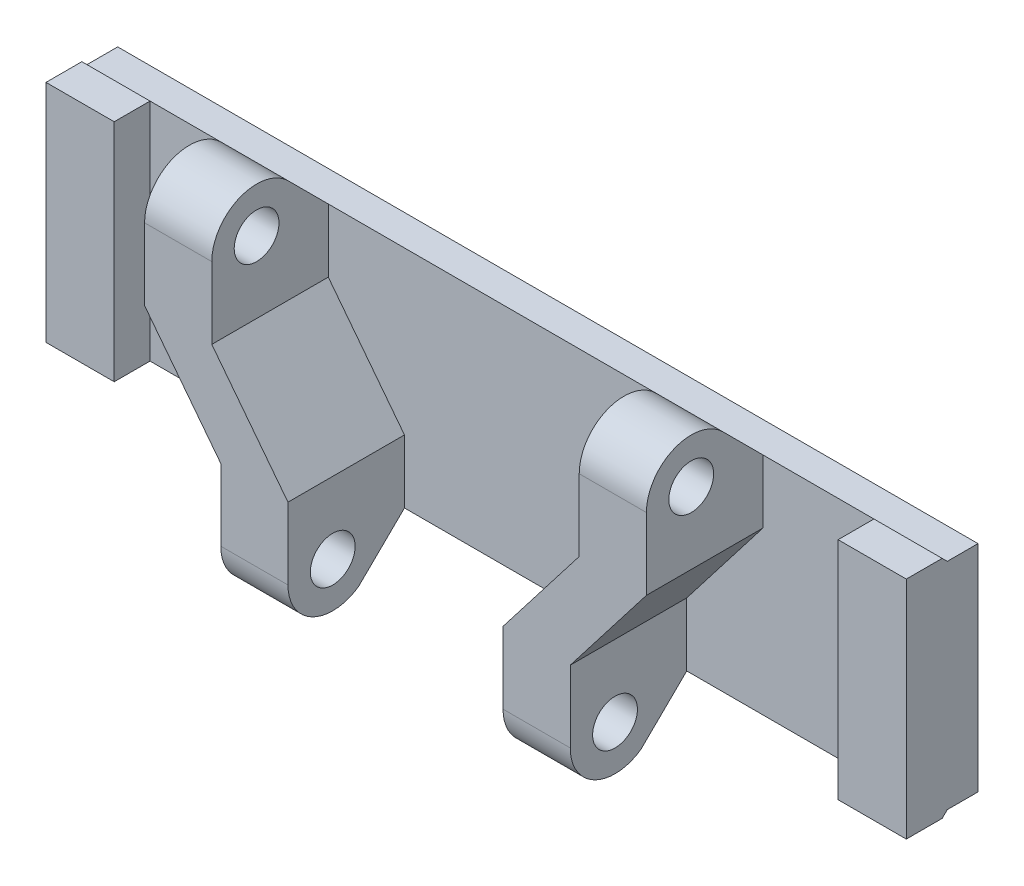
from build123d import *

# Parameters (mm, degrees)
ESBO_O9_R                         = 1.250000058
ESBO_O9_R_2                       = 1.250559391
RESSALTO_EXTRUS_O2_DEPTH          = 24
CORTE_EXTRUS_O5_DEPTH             = 28.088973642
CORTE_EXTRUS_O5_DEPTH_BACK        = 28.088973642
ESBO_O12_OUTSIDE_W                = 60.428
ESBO_O12_OUTSIDE_H                = 20.928
CORTE_EXTRUS_O6_REACH             = 29.089
ESBO_O13_W                        = 3.805227374
ESBO_O13_H                        = 1.999999904
ESBO_O13_W_2                      = 36.154186404
ESBO_O13_H_2                      = 31.243547385
ESBO_O13_H_3                      = 1.961388226
CORTE_EXTRUS_O6_DIRECTION_2_DEPTH = 5000


with BuildPart() as part:
    # Esboço9 → Ressalto-extrusão2 (new, symmetric)
    with BuildSketch(Plane(origin=(0, 0, 0), x_dir=(0, 0, -1), z_dir=(1, 0, 0))):
        with BuildLine():
            Line((0, -5.999999999), (0, 5.999999999))
            Line((0, 5.999999999), (-1.714464294, 6.00000012))
            Line((-1.714464294, 6.00000012), (-4.232231545, 8.517767251))
            ThreePointArc((-4.232231545, 8.517767251), (-6.956707169, 9.059699215), (-8.499999099, 6.7500006))
            Line((-8.499999099, 6.7500006), (-8.499999099, -6.749999877))
            ThreePointArc((-8.499999099, -6.749999877), (-7.153358538, -8.968070124), (-4.564293582, -8.794809974))
            Line((-4.564293582, -8.794809974), (-1.714465141, -5.999999999))
            Line((-1.714465141, -5.999999999), (0, -5.999999999))
        make_face()
        with Locations((-5.999998683, 6.749999894)):
            Circle(ESBO_O9_R, mode=Mode.SUBTRACT)
        with Locations((-6.001403792, -6.750869293)):
            Circle(ESBO_O9_R_2, mode=Mode.SUBTRACT)
    extrude(amount=RESSALTO_EXTRUS_O2_DEPTH, both=True)

    # Esboço12 outside → Corte-extrusão5 (cut, two sides: drawn at the far end of the back side and taken through both)
    with BuildSketch(Plane(origin=(0, 0, 0), x_dir=(1, 0, 0), z_dir=(0, 1, 0)).offset(-CORTE_EXTRUS_O5_DEPTH_BACK)):
        with Locations((0, -4.25)):
            Rectangle(ESBO_O12_OUTSIDE_W, ESBO_O12_OUTSIDE_H)
        Polygon((-24, -4), (-24, 0), (24, 0), (24, -4), (20.194772626, -4), (20.194772626, -2), (14, -2), (14, -9.171977472), (6, -9.171977472), (6, -2), (-6, -2), (-6, -9.171977472), (-14, -9.171977472), (-14, -2), (-20.194772626, -2), (-20.194772626, -4), align=None, mode=Mode.SUBTRACT)
    extrude(amount=CORTE_EXTRUS_O5_DEPTH + CORTE_EXTRUS_O5_DEPTH_BACK, mode=Mode.SUBTRACT)

    # Corte-extrusão6: up to this face of the body (flat: up to its plane)
    corte_extrus_o6_end = Plane(part.part.faces().sort_by_distance((-17.097386313, 0.002756729, 2))[0])
    # Esboço13 → Corte-extrusão6 (cut, up to the picked face)
    with BuildSketch(Plane.XY.offset(8.499999099), mode=Mode.PRIVATE) as corte_extrus_o6_sk1:
        with Locations((-22.097386313, 7.285535765)):
            Rectangle(ESBO_O13_W, ESBO_O13_H)
    corte_extrus_o6_tool1 = split(extrude(corte_extrus_o6_sk1.sketch, amount=-CORTE_EXTRUS_O6_REACH, mode=Mode.PRIVATE), bisect_by=corte_extrus_o6_end, keep=Keep.BOTH, mode=Mode.PRIVATE)
    # Esboço13 → Corte-extrusão6 (cut, up to the picked face)
    with BuildSketch(Plane.XY.offset(8.499999099), mode=Mode.PRIVATE) as corte_extrus_o6_sk2:
        with Locations((-0.25062362, -2.463016757)):
            Rectangle(ESBO_O13_W_2, ESBO_O13_H_2)
        Polygon((-14, 9.25000031), (-14, 2.75000031), (-9.75, -2.749464751), (-9.75, -9.249464751), (-6, -9.249464751), (-6, -2.749464751), (-10.25, 2.75000031), (-10.25, 9.25000031), align=None, mode=Mode.SUBTRACT)
        Polygon((6, -2.749464751), (6, -9.249464751), (9.75, -9.249464751), (9.75, -2.749464751), (14, 2.75000031), (14, 9.25000031), (10.25, 9.25000031), (10.25, 2.75000031), align=None, mode=Mode.SUBTRACT)
    corte_extrus_o6_tool2 = split(extrude(corte_extrus_o6_sk2.sketch, amount=-CORTE_EXTRUS_O6_REACH, mode=Mode.PRIVATE), bisect_by=corte_extrus_o6_end, keep=Keep.BOTH, mode=Mode.PRIVATE)
    # Esboço13 → Corte-extrusão6 (cut, up to the picked face)
    with BuildSketch(Plane.XY.offset(8.499999099), mode=Mode.PRIVATE) as corte_extrus_o6_sk3:
        with Locations((-22.097386313, -7.260716467)):
            Rectangle(ESBO_O13_W, ESBO_O13_H_3)
    corte_extrus_o6_tool3 = split(extrude(corte_extrus_o6_sk3.sketch, amount=-CORTE_EXTRUS_O6_REACH, mode=Mode.PRIVATE), bisect_by=corte_extrus_o6_end, keep=Keep.BOTH, mode=Mode.PRIVATE)
    # Esboço13 → Corte-extrusão6 (cut, up to the picked face)
    with BuildSketch(Plane.XY.offset(8.499999099), mode=Mode.PRIVATE) as corte_extrus_o6_sk4:
        with Locations((22.097386313, 7.285535765)):
            Rectangle(ESBO_O13_W, ESBO_O13_H)
    corte_extrus_o6_tool4 = split(extrude(corte_extrus_o6_sk4.sketch, amount=-CORTE_EXTRUS_O6_REACH, mode=Mode.PRIVATE), bisect_by=corte_extrus_o6_end, keep=Keep.BOTH, mode=Mode.PRIVATE)
    # Esboço13 → Corte-extrusão6 (cut, up to the picked face)
    with BuildSketch(Plane.XY.offset(8.499999099), mode=Mode.PRIVATE) as corte_extrus_o6_sk5:
        with Locations((22.097386313, -7.260716467)):
            Rectangle(ESBO_O13_W, ESBO_O13_H_3)
    corte_extrus_o6_tool5 = split(extrude(corte_extrus_o6_sk5.sketch, amount=-CORTE_EXTRUS_O6_REACH, mode=Mode.PRIVATE), bisect_by=corte_extrus_o6_end, keep=Keep.BOTH, mode=Mode.PRIVATE)
    add(corte_extrus_o6_tool1.solids().sort_by(Axis((-22.097386, 7.285536, 8.499999), (0, 0, -1)))[0], mode=Mode.SUBTRACT)
    add(corte_extrus_o6_tool2.solids().sort_by(Axis((-0.285718, -2.807947, 8.499999), (0, 0, -1)))[0], mode=Mode.SUBTRACT)
    add(corte_extrus_o6_tool3.solids().sort_by(Axis((-22.097386, -7.260716, 8.499999), (0, 0, -1)))[0], mode=Mode.SUBTRACT)
    add(corte_extrus_o6_tool4.solids().sort_by(Axis((22.097386, 7.285536, 8.499999), (0, 0, -1)))[0], mode=Mode.SUBTRACT)
    add(corte_extrus_o6_tool5.solids().sort_by(Axis((22.097386, -7.260716, 8.499999), (0, 0, -1)))[0], mode=Mode.SUBTRACT)

    # Esboço13 → Corte-extrusão6 direction 2 (cut)
    # profile 1 of 5: a face of its own
    with BuildSketch(Plane.XY.offset(8.499999099)):
        with Locations((-22.097386313, 7.285535765)):
            Rectangle(ESBO_O13_W, ESBO_O13_H)
    # profile 2 of 5: a face of its own
    with BuildSketch(Plane.XY.offset(8.499999099)):
        with Locations((-0.25062362, -2.463016757)):
            Rectangle(ESBO_O13_W_2, ESBO_O13_H_2)
        Polygon((-14, 9.25000031), (-14, 2.75000031), (-9.75, -2.749464751), (-9.75, -9.249464751), (-6, -9.249464751), (-6, -2.749464751), (-10.25, 2.75000031), (-10.25, 9.25000031), align=None, mode=Mode.SUBTRACT)
        Polygon((6, -2.749464751), (6, -9.249464751), (9.75, -9.249464751), (9.75, -2.749464751), (14, 2.75000031), (14, 9.25000031), (10.25, 9.25000031), (10.25, 2.75000031), align=None, mode=Mode.SUBTRACT)
    # profile 3 of 5: a face of its own
    with BuildSketch(Plane.XY.offset(8.499999099)):
        with Locations((-22.097386313, -7.260716467)):
            Rectangle(ESBO_O13_W, ESBO_O13_H_3)
    # profile 4 of 5: a face of its own
    with BuildSketch(Plane.XY.offset(8.499999099)):
        with Locations((22.097386313, 7.285535765)):
            Rectangle(ESBO_O13_W, ESBO_O13_H)
    # profile 5 of 5: a face of its own
    with BuildSketch(Plane.XY.offset(8.499999099)):
        with Locations((22.097386313, -7.260716467)):
            Rectangle(ESBO_O13_W, ESBO_O13_H_3)
    extrude(amount=CORTE_EXTRUS_O6_DIRECTION_2_DEPTH, mode=Mode.SUBTRACT)


solid = part.part
